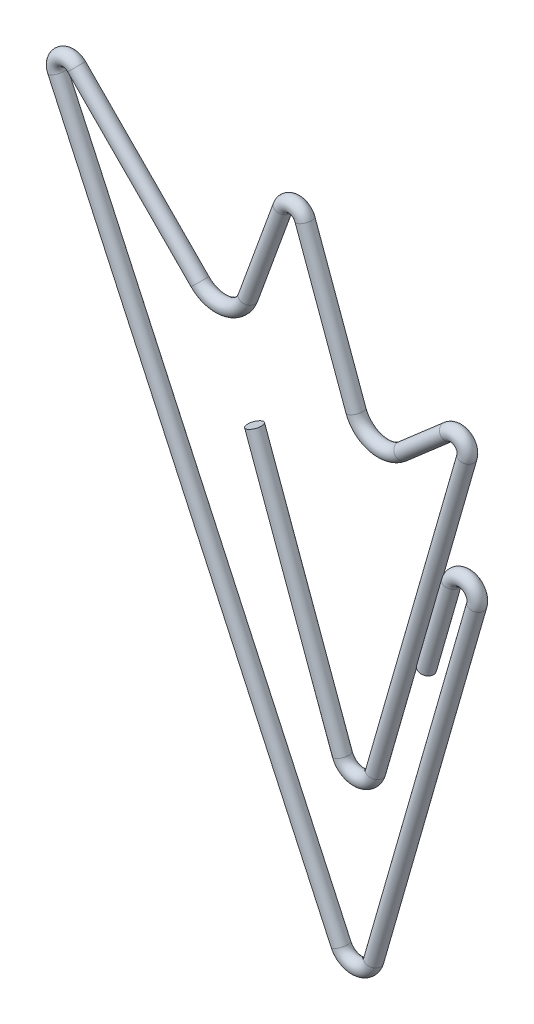
from build123d import *

# Parameters (mm, degrees)
SKETCH_3_R = 1.25


with BuildPart() as part:
    # По траектории1: sweep along a path in Эскиз2
    with BuildLine(Plane.XY) as sweep_1_path:
        Line((0, 0), (15.04062242, -41.323770473))
        ThreePointArc((15.04062242, -41.323770473), (17.964398772, -43.295882524), (20.74348537, -41.12462211))
        Line((20.74348537, -41.12462211), (36.40961648, 13.5096698))
        ThreePointArc((36.40961648, 13.5096698), (35.561692304, 15.747727404), (33.17497503, 15.570363672))
        Line((33.17497503, 15.570363672), (25.355340467, 8.772859053))
        ThreePointArc((25.355340467, 8.772859053), (20.823145302, 7.705668752), (17.376582218, 10.836306237))
        Line((17.376582218, 10.836306237), (8.641251009, 34.836431486))
        ThreePointArc((8.641251009, 34.836431486), (6.761865767, 36.1523912), (4.882480526, 34.836431486))
        Line((4.882480526, 34.836431486), (-1.095380554, 18.412393153))
        ThreePointArc((-1.095380554, 18.412393153), (-4.722790944, 15.23855631), (-9.3454812, 16.603137286))
        Line((-9.3454812, 16.603137286), (-30.491449591, 37.94306503))
        ThreePointArc((-30.491449591, 37.94306503), (-33.051766313, 38.178846414), (-33.728559982, 35.698369664))
        Line((-33.728559982, 35.698369664), (14.817205025, -69.661481986))
        ThreePointArc((14.817205025, -69.661481986), (17.770438026, -71.397334373), (20.425673174, -69.232964955))
        Line((20.425673174, -69.232964955), (38.092853802, -7.620184051))
        ThreePointArc((38.092853802, -7.620184051), (36.550199036, -4.837161184), (33.76717617, -6.379815949))
        Line((33.76717617, -6.379815949), (29.465995383, -21.379815949))
    # Эскиз3 → По траектории1 (sweep)
    with BuildSketch(Plane(origin=(0, 0, 0), x_dir=(-0.9396926207859081, -0.3420201433256697, 0), z_dir=(0.34202014332566966, -0.939692620785908, 0))):
        Circle(SKETCH_3_R)
    sweep(path=sweep_1_path.line)


solid = part.part
